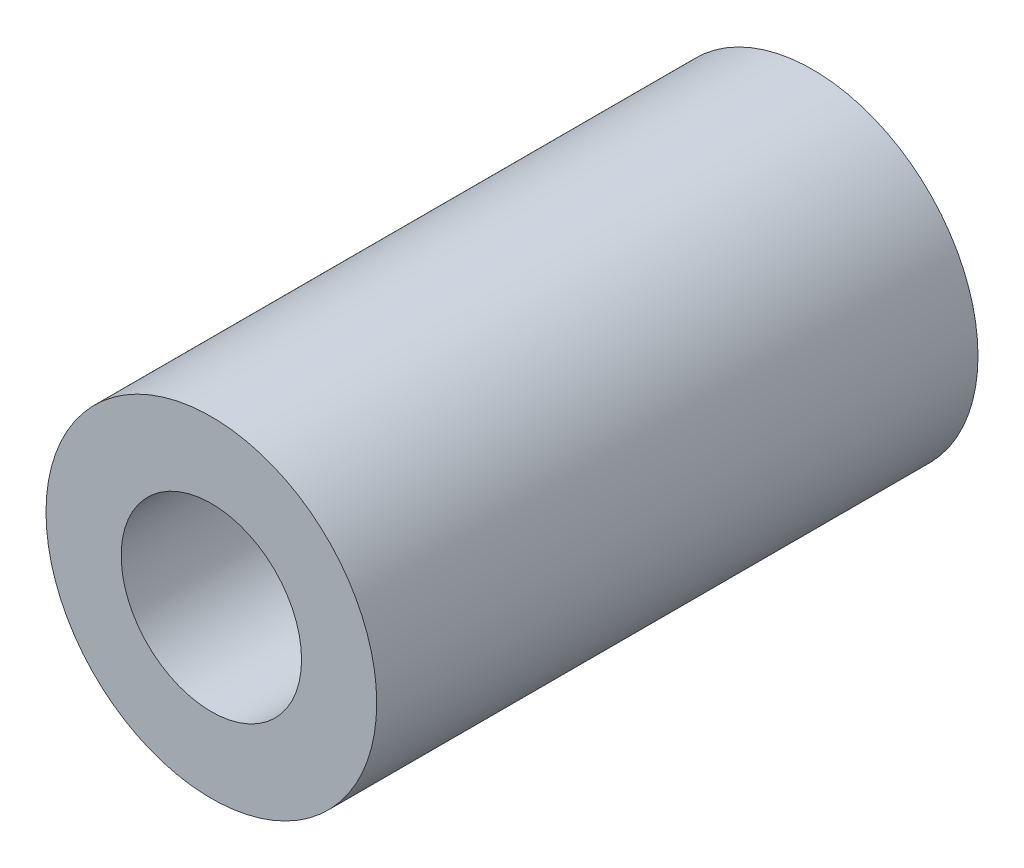
from build123d import *

# Parameters (mm, degrees)
SKETCH1_R           = 5.5
SKETCH1_R_2         = 3
BOSS_EXTRUDE1_DEPTH = 20


with BuildPart() as part:
    # Sketch1 → Boss-Extrude1 (new body)
    with BuildSketch(Plane.XY):
        Circle(SKETCH1_R)
        Circle(SKETCH1_R_2, mode=Mode.SUBTRACT)
    extrude(amount=BOSS_EXTRUDE1_DEPTH)


solid = part.part
